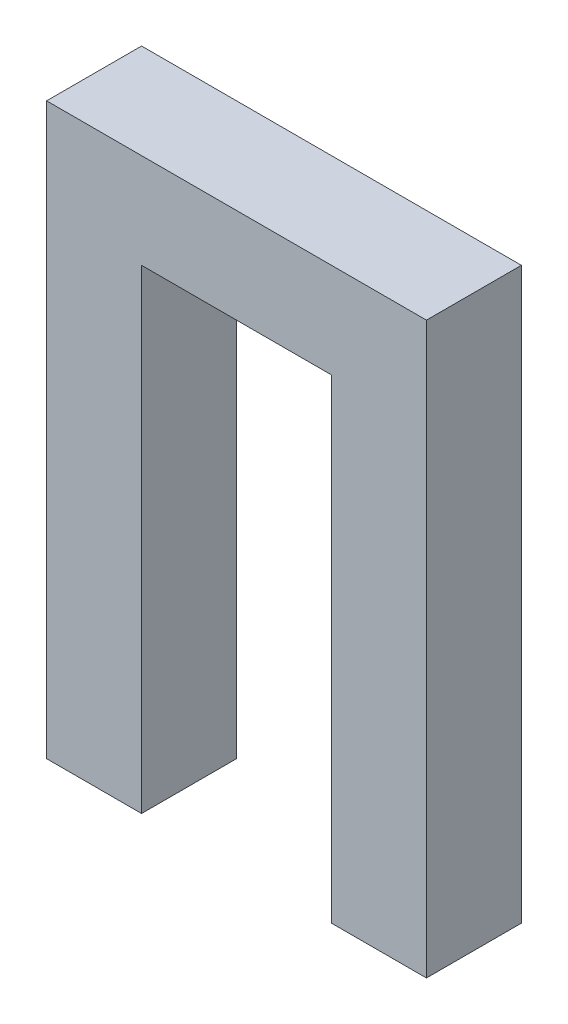
from build123d import *

# Parameters (mm, degrees)
Y_KSEKLIK_EKSTR_ZYON1_DEPTH = 10


with BuildPart() as part:
    # Çizim1 → Yükseklik-Ekstrüzyon1 (new body)
    with BuildSketch(Plane.XY):
        Polygon((-10, 60), (-10, 0), (0, 0), (0, 50), (20, 50), (20, 0), (30, 0), (30, 60), align=None)
    extrude(amount=Y_KSEKLIK_EKSTR_ZYON1_DEPTH)


solid = part.part
